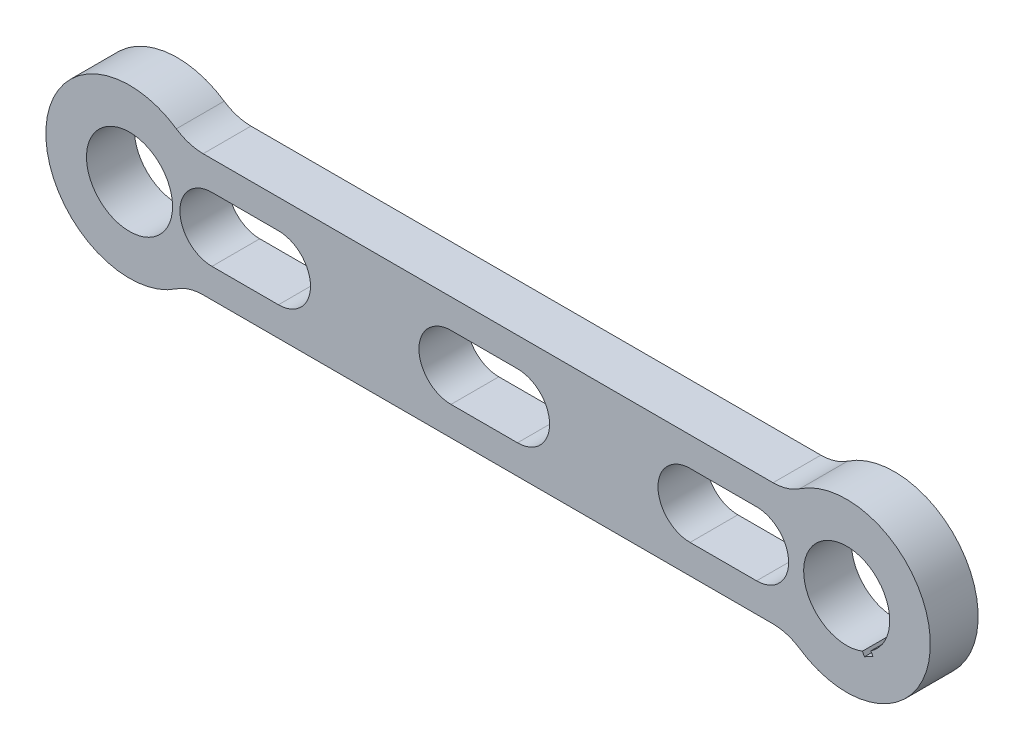
from build123d import *

# Parameters (mm, degrees)
SKETCH1_R           = 9
BOSS_EXTRUDE3_DEPTH = 10
FILLET1_R           = 10
CUT_EXTRUDE2_DEPTH  = 10


with BuildPart() as part:
    # Sketch1 → Boss-Extrude3 (new body)
    with BuildSketch(Plane.XY):
        with BuildLine():
            Line((-58.704034486, 12.783450444), (67.393380319, 12.783450444))
            ThreePointArc((67.393380319, 12.783450444), (96.844672917, 0), (67.393380319, -12.783450444))
            Line((67.393380319, -12.783450444), (-58.704034486, -12.783450444))
            ThreePointArc((-58.704034486, -12.783450444), (-88.155327083, 0), (-58.704034486, 12.783450444))
        make_face()
        with Locations((-70.655327083, 0)):
            Circle(SKETCH1_R, mode=Mode.SUBTRACT)
        with Locations((79.344672917, 0)):
            Circle(SKETCH1_R, mode=Mode.SUBTRACT)
        with BuildLine():
            Line((-53.412978839, 6.702415671), (-39.501397037, 6.702415671))
            ThreePointArc((-39.501397037, 6.702415671), (-32.798981366, 0), (-39.501397037, -6.702415671))
            Line((-39.501397037, -6.702415671), (-53.412978839, -6.702415671))
            ThreePointArc((-53.412978839, -6.702415671), (-60.11539451, 0), (-53.412978839, 6.702415671))
        make_face(mode=Mode.SUBTRACT)
        with BuildLine():
            Line((-3.412978839, 6.702415671), (10.498602963, 6.702415671))
            ThreePointArc((10.498602963, 6.702415671), (17.201018634, 0), (10.498602963, -6.702415671))
            Line((10.498602963, -6.702415671), (-3.412978839, -6.702415671))
            ThreePointArc((-3.412978839, -6.702415671), (-10.11539451, 0), (-3.412978839, 6.702415671))
        make_face(mode=Mode.SUBTRACT)
        with BuildLine():
            Line((46.587021161, 6.702415671), (60.498602963, 6.702415671))
            ThreePointArc((60.498602963, 6.702415671), (67.201018634, 0), (60.498602963, -6.702415671))
            Line((60.498602963, -6.702415671), (46.587021161, -6.702415671))
            ThreePointArc((46.587021161, -6.702415671), (39.88460549, 0), (46.587021161, 6.702415671))
        make_face(mode=Mode.SUBTRACT)
    extrude(amount=BOSS_EXTRUDE3_DEPTH)

    # Fillet1
    fillet1_edges = [part.edges().sort_by_distance(p)[0] for p in [
        (67.393380319, -12.783450444, 5),
        (-58.704034486, -12.783450444, 5),
        (-58.704034486, 12.783450444, 5),
        (67.393380319, 12.783450444, 5),
    ]]
    fillet(fillet1_edges, radius=FILLET1_R)

    # Sketch4 → Cut-Extrude2 (cut)
    with BuildSketch(Plane.XY.offset(10)):
        Polygon((82.625844791, -8.343662686), (83.067179358, -9.178208957), (84.835179052, -8.243234581), (84.393844485, -7.40868831), align=None)
    extrude(amount=-CUT_EXTRUDE2_DEPTH, mode=Mode.SUBTRACT)


solid = part.part
